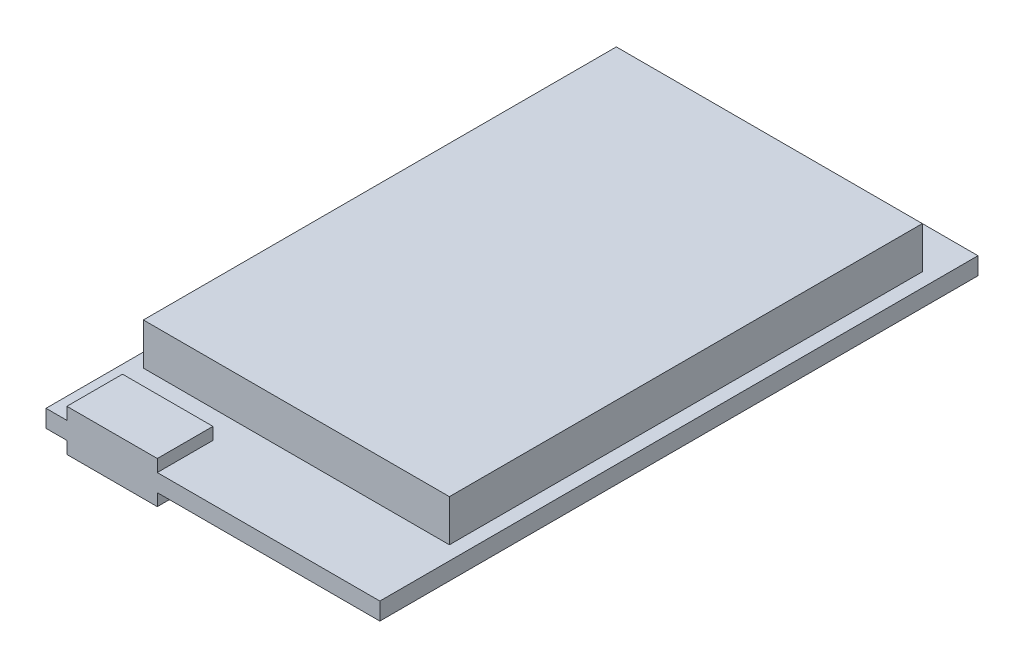
from build123d import *

# Parameters (mm, degrees)
SKETCH1_W       = 24
SKETCH1_H       = 43
PCB_DEPTH       = 1.25
SKETCH2_W       = 22
SKETCH2_H       = 34
RF_CASING_DEPTH = 3
SKETCH5_W       = 6.5
SKETCH5_H       = 3
PINS_DEPTH      = 4


with BuildPart() as part:
    # Sketch1 → PCB (new body)
    with BuildSketch(Plane(origin=(0, 0, 0), x_dir=(1, 0, 0), z_dir=(0, 1, 0))):
        Rectangle(SKETCH1_W, SKETCH1_H)
    extrude(amount=PCB_DEPTH)

    # Sketch2 → RF Casing (add)
    with BuildSketch(Plane(origin=(0, 1.25, 0), x_dir=(1, 0, 0), z_dir=(0, 1, 0))):
        with Locations((0, 1.5)):
            Rectangle(SKETCH2_W, SKETCH2_H)
    extrude(amount=RF_CASING_DEPTH)

    # Sketch5 → Pins (add)
    with BuildSketch(Plane.XY.offset(21.5)):
        with Locations((-7.249153049, 0.625)):
            Rectangle(SKETCH5_W, SKETCH5_H)
    extrude(amount=-PINS_DEPTH)


solid = part.part
